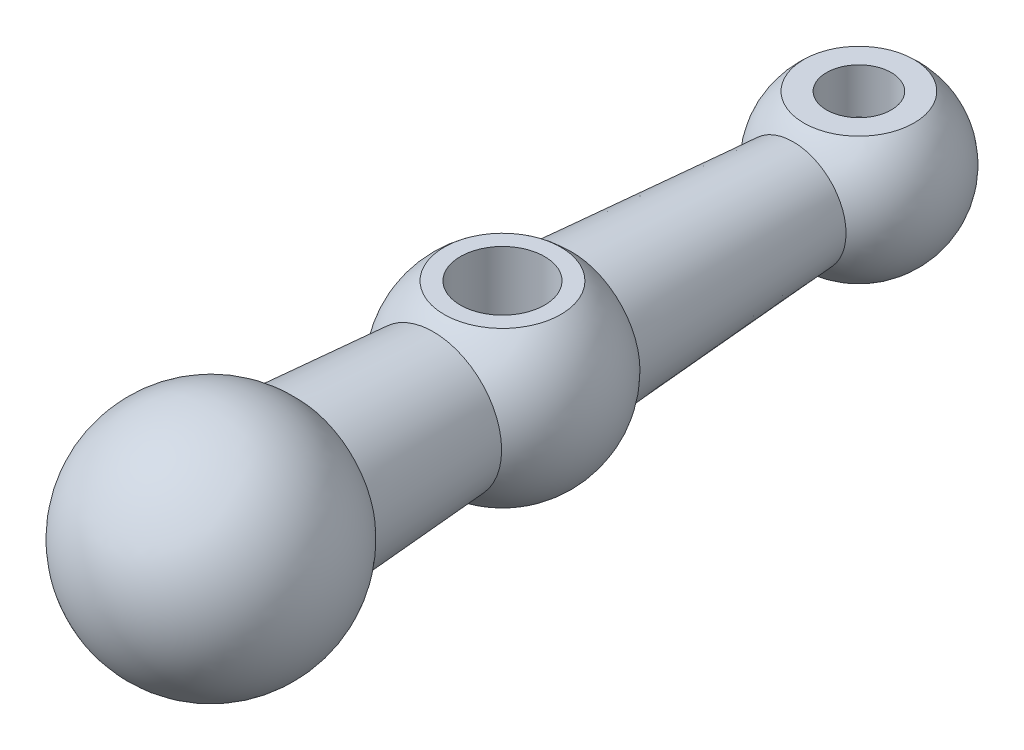
from build123d import *

# Parameters (mm, degrees)
CUT_EXTRUDE1_DEPTH         = 73.608539
CUT_EXTRUDE1_DEPTH_BACK    = 73.608539
SKETCH2_R                  = 6.5
CUT_EXTRUDE7_DEPTH         = 73.608539
CUT_EXTRUDE7_DEPTH_BACK    = 12
F_10_0MM_DOWEL_HOLE1_D     = 10
F_10_0MM_DOWEL_HOLE1_DEPTH = 6.995697
F_10_0MM_DOWEL_HOLE1_TIP   = 3.004303


with BuildPart() as part:
    # Sketch1 → Revolve1 (revolve)
    with BuildSketch(Plane(origin=(0, 0, 0), x_dir=(0, 0, -1), z_dir=(1, 0, 0))):
        with BuildLine():
            Line((-63, 0), (68, 0))
            ThreePointArc((68, 0), (59.318672, 12.261691), (44.869373, 8.146803))
            Line((44.869373, 8.146803), (10.674844, 10.537918))
            ThreePointArc((10.674844, 10.537918), (0, 15), (-10.674844, 10.537918))
            Line((-10.674844, 10.537918), (-31.583592, 12))
            ThreePointArc((-31.583592, 12), (-51.422798, 16.815102), (-63, 0))
        make_face()
    revolve(axis=Axis((0, 0, 63), (0, 0, -1)))

    # Sketch2 → Cut-Extrude1 (cut, two sides: drawn at the far end of the back side and taken through both)
    with BuildSketch(Plane(origin=(0, 0, 0), x_dir=(1, 0, 0), z_dir=(0, 1, 0)).offset(-CUT_EXTRUDE1_DEPTH_BACK)):
        with Locations(Location((0, 0, 0), (0, 0, 270))):
            Circle(SKETCH2_R)
    extrude(amount=CUT_EXTRUDE1_DEPTH + CUT_EXTRUDE1_DEPTH_BACK, mode=Mode.SUBTRACT)

    # Sketch6 → Cut-Extrude7 (cut, two sides: drawn at the far end of the back side and taken through both)
    with BuildSketch(Plane(origin=(0, 0, 0), x_dir=(0, 0, -1), z_dir=(1, 0, 0)).offset(-CUT_EXTRUDE7_DEPTH_BACK)):
        with BuildLine():
            Line((6.5, 13.518506), (-6.5, 13.518506))
            ThreePointArc((-6.5, 13.518506), (-7.787102, 12.820337), (-9, 12))
            Line((-9, 12), (9, 12))
            ThreePointArc((9, 12), (7.787102, 12.820337), (6.5, 13.518506))
        make_face()
        with BuildLine():
            Line((9, -12), (-9, -12))
            ThreePointArc((-9, -12), (-7.787102, -12.820337), (-6.5, -13.518506))
            Line((-6.5, -13.518506), (6.5, -13.518506))
            ThreePointArc((6.5, -13.518506), (7.787102, -12.820337), (9, -12))
        make_face()
        with BuildLine():
            Line((46.5, 9.836158), (63.5, 9.836158))
            ThreePointArc((63.5, 9.836158), (55, 13), (46.5, 9.836158))
        make_face()
    extrude(amount=CUT_EXTRUDE7_DEPTH + CUT_EXTRUDE7_DEPTH_BACK, mode=Mode.SUBTRACT)

    # Ø10.0mm Dowel Hole1
    with Locations(Plane(origin=(0, 9.836158, -55), x_dir=(0, 0, 1), z_dir=(0, 1, 0))):
        with Locations((0, 0)):
            Hole(F_10_0MM_DOWEL_HOLE1_D / 2, depth=F_10_0MM_DOWEL_HOLE1_DEPTH)
            with Locations((0, 0, -(F_10_0MM_DOWEL_HOLE1_DEPTH + F_10_0MM_DOWEL_HOLE1_TIP / 2))):  # 118° drill point
                Cone(0, F_10_0MM_DOWEL_HOLE1_D / 2, F_10_0MM_DOWEL_HOLE1_TIP, mode=Mode.SUBTRACT)


solid = part.part
